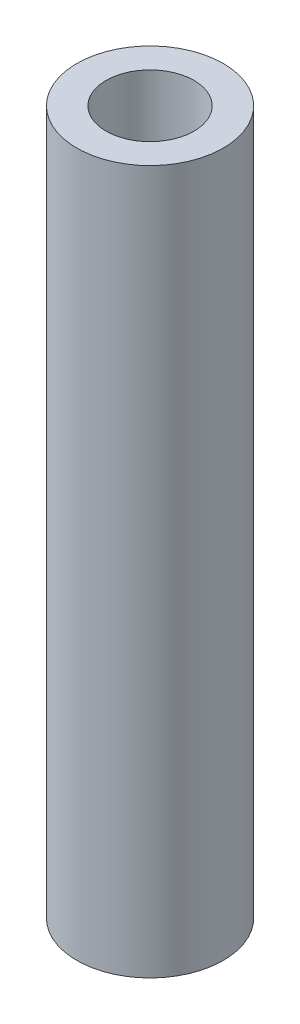
from build123d import *

# Parameters (mm, degrees)
SKETCH1_R           = 7.9375
SKETCH1_R_2         = 4.7625
BOSS_EXTRUDE1_DEPTH = 76.2


with BuildPart() as part:
    # Sketch1 → Boss-Extrude1 (new body)
    with BuildSketch(Plane(origin=(0, 0, 0), x_dir=(1, 0, 0), z_dir=(0, 1, 0))):
        with Locations(Location((0, 0, 0), (0, 0, 90))):
            Circle(SKETCH1_R)
        with Locations(Location((0, 0, 0), (0, 0, 90))):
            Circle(SKETCH1_R_2, mode=Mode.SUBTRACT)
    extrude(amount=BOSS_EXTRUDE1_DEPTH)


solid = part.part
